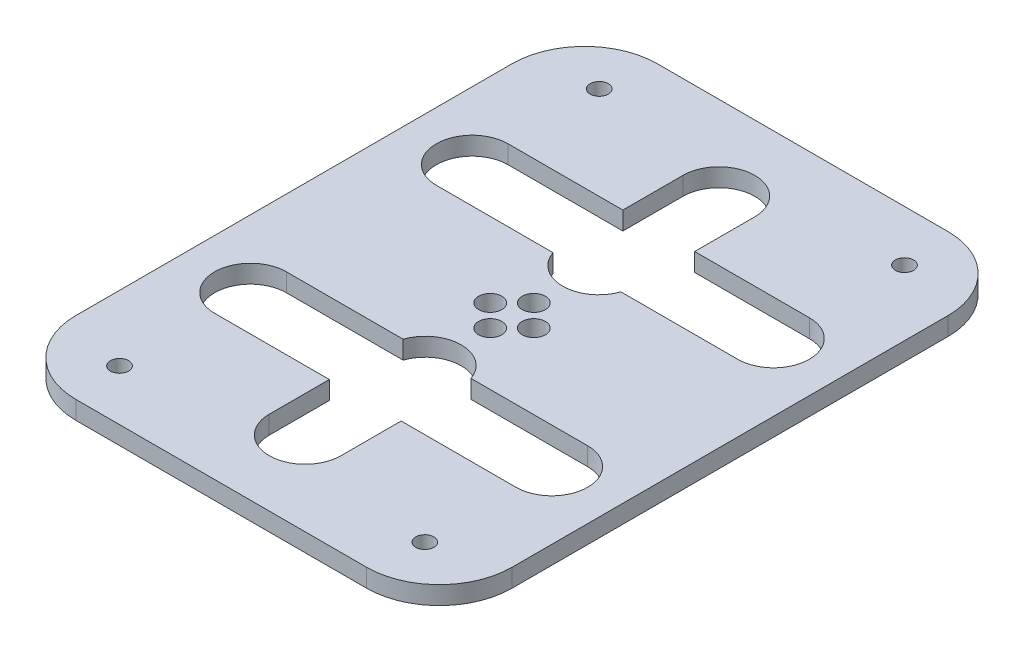
from build123d import *

# Parameters (mm, degrees)
SKETCH_1_W          = 60
SKETCH_1_H          = 80
SKETCH_1_R          = 1.25
SKETCH_1_R_2        = 1.6
EXTRUDE_1_DEPTH     = 2.5
FILLET_1_R          = 10
CUT_EXTRUDE_1_DEPTH = 2.5
CUT_EXTRUDE_2_DEPTH = 2.5


with BuildPart() as part:
    # 草图1 → 凸台-拉伸1 (new body)
    with BuildSketch(Plane(origin=(0, 0, 0), x_dir=(1, 0, 0), z_dir=(0, 1, 0))):
        Rectangle(SKETCH_1_W, SKETCH_1_H)
        with Locations(Location((21, 33, 0), (0, 0, 270))):
            Circle(SKETCH_1_R, mode=Mode.SUBTRACT)
        with Locations(Location((-21, 33, 0), (0, 0, 90))):
            Circle(SKETCH_1_R, mode=Mode.SUBTRACT)
        with Locations(Location((-21, -33, 0), (0, 0, 270))):
            Circle(SKETCH_1_R, mode=Mode.SUBTRACT)
        with Locations(Location((21, -33, 0), (0, 0, 90))):
            Circle(SKETCH_1_R, mode=Mode.SUBTRACT)
        with Locations(Location((0, 3, 0), (0, 0, 270))):
            Circle(SKETCH_1_R_2, mode=Mode.SUBTRACT)
        with Locations(Location((3, 0, 0), (0, 0, 270))):
            Circle(SKETCH_1_R_2, mode=Mode.SUBTRACT)
        with Locations(Location((0, -3, 0), (0, 0, 90))):
            Circle(SKETCH_1_R_2, mode=Mode.SUBTRACT)
        with Locations(Location((-3, 0, 0), (0, 0, 90))):
            Circle(SKETCH_1_R_2, mode=Mode.SUBTRACT)
    extrude(amount=EXTRUDE_1_DEPTH)

    # 圆角1
    fillet_1_edges = [part.edges().sort_by_distance(p)[0] for p in [
        (30, 1.25, 40),
        (-30, 1.25, 40),
        (-30, 1.25, -40),
        (30, 1.25, -40),
    ]]
    fillet(fillet_1_edges, radius=FILLET_1_R)

    # 草图2 → 切除-拉伸1 (cut)
    with BuildSketch(Plane(origin=(0, 2.5, 0), x_dir=(1, 0, 0), z_dir=(0, 1, 0))):
        with BuildLine():
            Line((-20.730933361, 20.193862548), (20.730933361, 20.193862548))
            ThreePointArc((20.730933361, 20.193862548), (25.671984835, 15.252811074), (20.730933361, 10.311759599))
            Line((20.730933361, 10.311759599), (-20.730933361, 10.311759599))
            ThreePointArc((-20.730933361, 10.311759599), (-25.671984835, 15.252811074), (-20.730933361, 20.193862548))
        make_face()
        with BuildLine():
            Line((-20.730933361, -20.193862548), (20.730933361, -20.193862548))
            ThreePointArc((20.730933361, -20.193862548), (25.671984835, -15.252811074), (20.730933361, -10.311759599))
            Line((20.730933361, -10.311759599), (-20.730933361, -10.311759599))
            ThreePointArc((-20.730933361, -10.311759599), (-25.671984835, -15.252811074), (-20.730933361, -20.193862548))
        make_face()
    extrude(amount=-CUT_EXTRUDE_1_DEPTH, mode=Mode.SUBTRACT)

    # 草图3 → 切除-拉伸2 (cut)
    with BuildSketch(Plane(origin=(0, 2.5, 0), x_dir=(1, 0, 0), z_dir=(0, 1, 0))):
        with BuildLine():
            Line((-4.941051475, 11.922972036), (-4.941051475, 28.46475306))
            ThreePointArc((-4.941051475, 28.46475306), (0, 33.405804535), (4.941051475, 28.46475306))
            Line((4.941051475, 28.46475306), (4.941051475, 11.922972036))
            ThreePointArc((4.941051475, 11.922972036), (0, 6.981920562), (-4.941051475, 11.922972036))
        make_face()
        with BuildLine():
            Line((-4.941051475, -11.922972036), (-4.941051475, -28.46475306))
            ThreePointArc((-4.941051475, -28.46475306), (0, -33.405804535), (4.941051475, -28.46475306))
            Line((4.941051475, -28.46475306), (4.941051475, -11.922972036))
            ThreePointArc((4.941051475, -11.922972036), (0, -6.981920562), (-4.941051475, -11.922972036))
        make_face()
    extrude(amount=-CUT_EXTRUDE_2_DEPTH, mode=Mode.SUBTRACT)


solid = part.part
